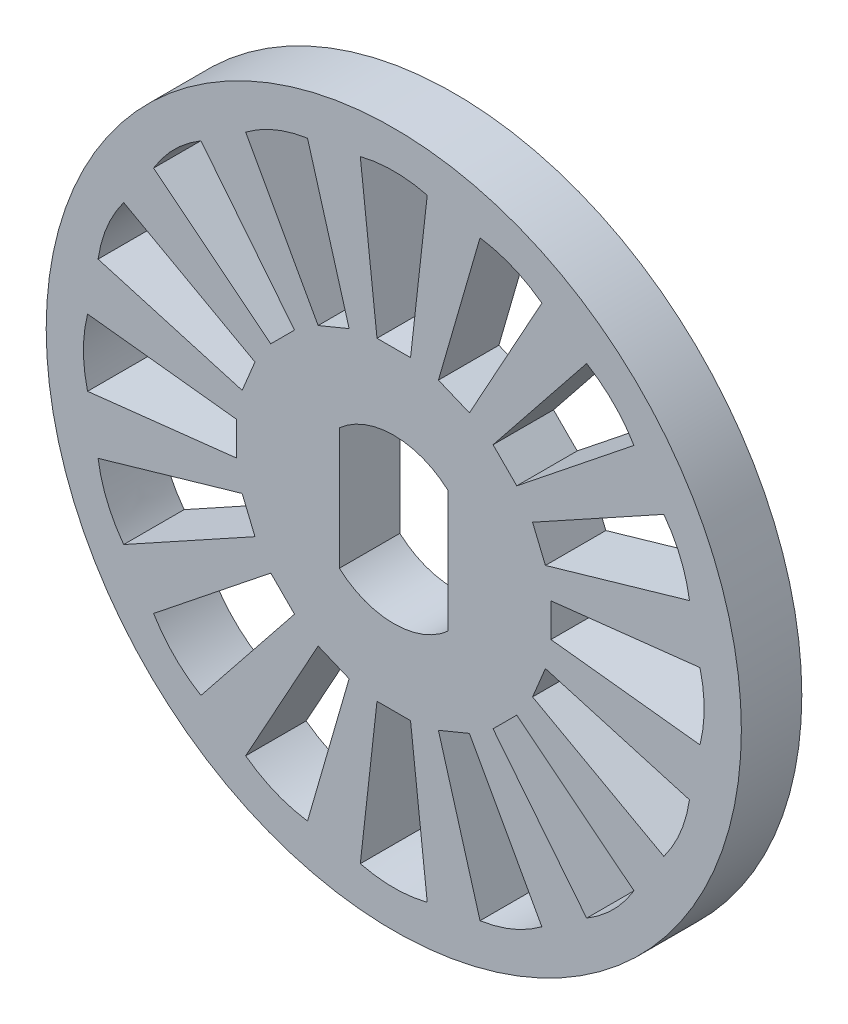
from build123d import *

# Parameters (mm, degrees)
SKETCH1_R           = 11.5
BOSS_EXTRUDE1_DEPTH = 2
CUT_EXTRUDE1_DEPTH  = 2
CUT_EXTRUDE2_DEPTH  = 2


with BuildPart() as part:
    # Sketch1 → Boss-Extrude1 (new body)
    with BuildSketch(Plane.XY):
        Circle(SKETCH1_R)
    extrude(amount=BOSS_EXTRUDE1_DEPTH)

    # Sketch2 → Cut-Extrude1 (cut)
    with BuildSketch(Plane.XY.offset(2)):
        with BuildLine():
            Line((1.8, 2.01246118), (1.8, -2.01246118))
            ThreePointArc((1.8, -2.01246118), (0, -2.7), (-1.8, -2.01246118))
            Line((-1.8, -2.01246118), (-1.8, 2.01246118))
            ThreePointArc((-1.8, 2.01246118), (0, 2.7), (1.8, 2.01246118))
        make_face()
    extrude(amount=-CUT_EXTRUDE1_DEPTH, mode=Mode.SUBTRACT)

    # Sketch3 → Cut-Extrude2 (cut)
    with BuildSketch(Plane.XY.offset(2)):
        with BuildLine():
            Line((-0.554979585, 5.2), (0.554979585, 5.2))
            Line((0.554979585, 5.2), (1.107336195, 10.130831273))
            add(Edge.make_bspline(
                [(-1.107336195, 10.130831273), (0, 10.407084111), (1.107336195, 10.130831273)],
                knots=[0, 0, 0, 1, 1, 1], degree=2))
            Line((-1.107336195, 10.130831273), (-0.554979585, 5.2))
        make_face()
        with BuildLine():
            Line((2.502688127, 4.591792077), (4.89994653, 8.935908445))
            add(Edge.make_bspline(
                [(2.853856038, 9.783426876), (3.982618669, 9.614892003), (4.89994653, 8.935908445)],
                knots=[0, 0, 0, 1, 1, 1], degree=2))
            Line((2.853856038, 9.783426876), (1.477219569, 5.016555061))
            Line((1.477219569, 5.016555061), (2.502688127, 4.591792077))
        make_face()
        with BuildLine():
            Line((4.06938509, 3.284525434), (7.946584425, 6.38057456))
            add(Edge.make_bspline(
                [(6.38057456, 7.946584425), (7.358919747, 7.358919747), (7.946584425, 6.38057456)],
                knots=[0, 0, 0, 1, 1, 1], degree=2))
            Line((6.38057456, 7.946584425), (3.284525434, 4.06938509))
            Line((3.284525434, 4.06938509), (4.06938509, 3.284525434))
        make_face()
        with BuildLine():
            Line((5.016555061, 1.477219569), (9.783426876, 2.853856038))
            add(Edge.make_bspline(
                [(8.935908445, 4.89994653), (9.614892003, 3.982618669), (9.783426876, 2.853856038)],
                knots=[0, 0, 0, 1, 1, 1], degree=2))
            Line((8.935908445, 4.89994653), (4.591792077, 2.502688127))
            Line((4.591792077, 2.502688127), (5.016555061, 1.477219569))
        make_face()
        with BuildLine():
            Line((5.2, -0.554979585), (10.130831273, -1.107336195))
            add(Edge.make_bspline(
                [(10.130831273, 1.107336195), (10.407084111, 0), (10.130831273, -1.107336195)],
                knots=[0, 0, 0, 1, 1, 1], degree=2))
            Line((10.130831273, 1.107336195), (5.2, 0.554979585))
            Line((5.2, 0.554979585), (5.2, -0.554979585))
        make_face()
        with BuildLine():
            Line((4.591792077, -2.502688127), (8.935908445, -4.89994653))
            add(Edge.make_bspline(
                [(9.783426876, -2.853856038), (9.614892003, -3.982618669), (8.935908445, -4.89994653)],
                knots=[0, 0, 0, 1, 1, 1], degree=2))
            Line((9.783426876, -2.853856038), (5.016555061, -1.477219569))
            Line((5.016555061, -1.477219569), (4.591792077, -2.502688127))
        make_face()
        with BuildLine():
            Line((3.284525434, -4.06938509), (6.38057456, -7.946584425))
            add(Edge.make_bspline(
                [(7.946584425, -6.38057456), (7.358919747, -7.358919747), (6.38057456, -7.946584425)],
                knots=[0, 0, 0, 1, 1, 1], degree=2))
            Line((7.946584425, -6.38057456), (4.06938509, -3.284525434))
            Line((4.06938509, -3.284525434), (3.284525434, -4.06938509))
        make_face()
        with BuildLine():
            Line((1.477219569, -5.016555061), (2.853856038, -9.783426876))
            add(Edge.make_bspline(
                [(4.89994653, -8.935908445), (3.982618669, -9.614892003), (2.853856038, -9.783426876)],
                knots=[0, 0, 0, 1, 1, 1], degree=2))
            Line((4.89994653, -8.935908445), (2.502688127, -4.591792077))
            Line((2.502688127, -4.591792077), (1.477219569, -5.016555061))
        make_face()
        with BuildLine():
            Line((-0.554979585, -5.2), (-1.107336195, -10.130831273))
            add(Edge.make_bspline(
                [(1.107336195, -10.130831273), (0, -10.407084111), (-1.107336195, -10.130831273)],
                knots=[0, 0, 0, 1, 1, 1], degree=2))
            Line((1.107336195, -10.130831273), (0.554979585, -5.2))
            Line((0.554979585, -5.2), (-0.554979585, -5.2))
        make_face()
        with BuildLine():
            Line((-2.502688127, -4.591792077), (-4.89994653, -8.935908445))
            add(Edge.make_bspline(
                [(-2.853856038, -9.783426876), (-3.982618669, -9.614892003), (-4.89994653, -8.935908445)],
                knots=[0, 0, 0, 1, 1, 1], degree=2))
            Line((-2.853856038, -9.783426876), (-1.477219569, -5.016555061))
            Line((-1.477219569, -5.016555061), (-2.502688127, -4.591792077))
        make_face()
        with BuildLine():
            Line((-4.06938509, -3.284525434), (-7.946584425, -6.38057456))
            add(Edge.make_bspline(
                [(-6.38057456, -7.946584425), (-7.358919747, -7.358919747), (-7.946584425, -6.38057456)],
                knots=[0, 0, 0, 1, 1, 1], degree=2))
            Line((-6.38057456, -7.946584425), (-3.284525434, -4.06938509))
            Line((-3.284525434, -4.06938509), (-4.06938509, -3.284525434))
        make_face()
        with BuildLine():
            Line((-5.016555061, -1.477219569), (-9.783426876, -2.853856038))
            add(Edge.make_bspline(
                [(-8.935908445, -4.89994653), (-9.614892003, -3.982618669), (-9.783426876, -2.853856038)],
                knots=[0, 0, 0, 1, 1, 1], degree=2))
            Line((-8.935908445, -4.89994653), (-4.591792077, -2.502688127))
            Line((-4.591792077, -2.502688127), (-5.016555061, -1.477219569))
        make_face()
        with BuildLine():
            Line((-5.2, 0.554979585), (-10.130831273, 1.107336195))
            add(Edge.make_bspline(
                [(-10.130831273, -1.107336195), (-10.407084111, 0), (-10.130831273, 1.107336195)],
                knots=[0, 0, 0, 1, 1, 1], degree=2))
            Line((-10.130831273, -1.107336195), (-5.2, -0.554979585))
            Line((-5.2, -0.554979585), (-5.2, 0.554979585))
        make_face()
        with BuildLine():
            Line((-4.591792077, 2.502688127), (-8.935908445, 4.89994653))
            add(Edge.make_bspline(
                [(-9.783426876, 2.853856038), (-9.614892003, 3.982618669), (-8.935908445, 4.89994653)],
                knots=[0, 0, 0, 1, 1, 1], degree=2))
            Line((-9.783426876, 2.853856038), (-5.016555061, 1.477219569))
            Line((-5.016555061, 1.477219569), (-4.591792077, 2.502688127))
        make_face()
        with BuildLine():
            Line((-3.284525434, 4.06938509), (-6.38057456, 7.946584425))
            add(Edge.make_bspline(
                [(-7.946584425, 6.38057456), (-7.358919747, 7.358919747), (-6.38057456, 7.946584425)],
                knots=[0, 0, 0, 1, 1, 1], degree=2))
            Line((-7.946584425, 6.38057456), (-4.06938509, 3.284525434))
            Line((-4.06938509, 3.284525434), (-3.284525434, 4.06938509))
        make_face()
        with BuildLine():
            Line((-1.477219569, 5.016555061), (-2.853856038, 9.783426876))
            add(Edge.make_bspline(
                [(-4.89994653, 8.935908445), (-3.982618669, 9.614892003), (-2.853856038, 9.783426876)],
                knots=[0, 0, 0, 1, 1, 1], degree=2))
            Line((-4.89994653, 8.935908445), (-2.502688127, 4.591792077))
            Line((-2.502688127, 4.591792077), (-1.477219569, 5.016555061))
        make_face()
    extrude(amount=-CUT_EXTRUDE2_DEPTH, mode=Mode.SUBTRACT)


solid = part.part
